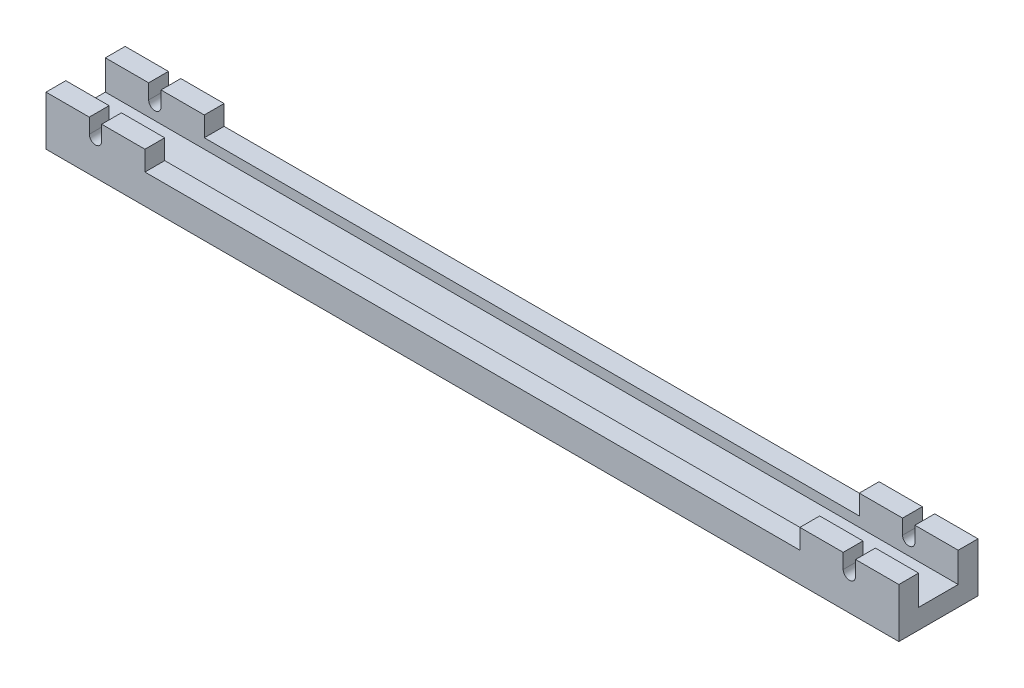
from build123d import *

# Parameters (mm, degrees)
SKETCH1_W           = 43.1
SKETCH1_H           = 8
BOSS_EXTRUDE1_DEPTH = 2
SKETCH2_W           = 10
SKETCH2_H           = 2
BOSS_EXTRUDE2_DEPTH = 3
SKETCH3_W           = 33.1
SKETCH3_H           = 2
BOSS_EXTRUDE3_DEPTH = 1
CUT_EXTRUDE1_DEPTH  = 45.120403443


with BuildPart() as part:
    # Sketch1 → Boss-Extrude1 (new body)
    with BuildSketch(Plane(origin=(0, 0, 0), x_dir=(1, 0, 0), z_dir=(0, 1, 0))):
        with Locations((21.55, 0)):
            Rectangle(SKETCH1_W, SKETCH1_H)
    boss_extrude1 = extrude(amount=BOSS_EXTRUDE1_DEPTH)

    # Sketch2 → Boss-Extrude2 (add)
    with BuildSketch(Plane(origin=(0, 2, 0), x_dir=(1, 0, 0), z_dir=(0, 1, 0))):
        with Locations((38.1, -3)):
            Rectangle(SKETCH2_W, SKETCH2_H)
        with Locations((38.1, 3)):
            Rectangle(SKETCH2_W, SKETCH2_H)
    boss_extrude2 = extrude(amount=BOSS_EXTRUDE2_DEPTH)

    # Sketch3 → Boss-Extrude3 (add)
    with BuildSketch(Plane(origin=(0, 2, 0), x_dir=(1, 0, 0), z_dir=(0, 1, 0))):
        with Locations((16.55, -3)):
            Rectangle(SKETCH3_W, SKETCH3_H)
        with Locations((16.55, 3)):
            Rectangle(SKETCH3_W, SKETCH3_H)
    boss_extrude3 = extrude(amount=BOSS_EXTRUDE3_DEPTH)

    # Sketch4 → Cut-Extrude1 (cut, through all)
    with BuildSketch(Plane.XY.offset(4)):
        with BuildLine():
            Line((37.475, 3.5), (37.475, 5))
            Line((37.475, 5), (38.725, 5))
            Line((38.725, 5), (38.725, 3.5))
            ThreePointArc((38.725, 3.5), (38.1, 2.875), (37.475, 3.5))
        make_face()
    cut_extrude1 = extrude(amount=-CUT_EXTRUDE1_DEPTH, mode=Mode.SUBTRACT)

    # Mirror1: Boss-Extrude1, Boss-Extrude2, Boss-Extrude3, Cut-Extrude1 across plane
    add(boss_extrude1.mirror(Plane(origin=(0, 0, 0), x_dir=(0, 0, 1), z_dir=(1, 0, 0))))
    add(boss_extrude2.mirror(Plane(origin=(0, 0, 0), x_dir=(0, 0, 1), z_dir=(1, 0, 0))))
    add(boss_extrude3.mirror(Plane(origin=(0, 0, 0), x_dir=(0, 0, 1), z_dir=(1, 0, 0))))
    add(cut_extrude1.mirror(Plane(origin=(0, 0, 0), x_dir=(0, 0, 1), z_dir=(1, 0, 0))), mode=Mode.SUBTRACT)


solid = part.part
